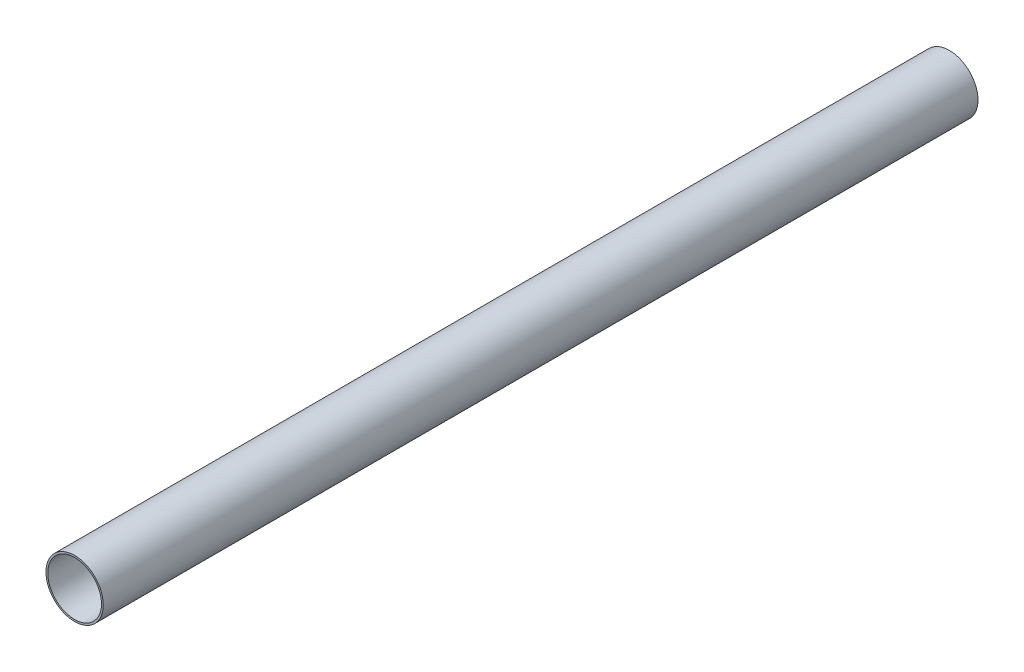
from build123d import *

# Parameters (mm, degrees)
SKETCH1_R           = 12.7
SKETCH1_R_2         = 11.90625
BOSS_EXTRUDE1_DEPTH = 387.62


with BuildPart() as part:
    # Sketch1 → Boss-Extrude1 (new body)
    with BuildSketch(Plane.XY):
        Circle(SKETCH1_R)
        Circle(SKETCH1_R_2, mode=Mode.SUBTRACT)
    extrude(amount=BOSS_EXTRUDE1_DEPTH)


solid = part.part
